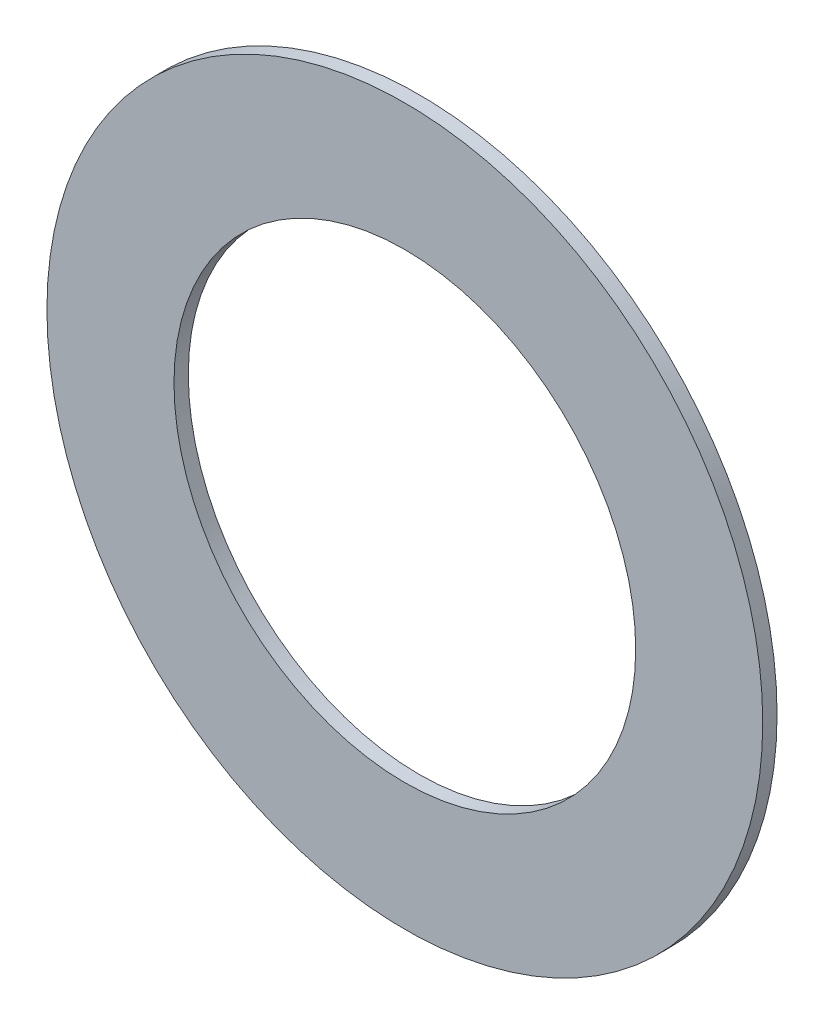
from build123d import *

# Parameters (mm, degrees)
SKETCH1_R           = 31.75
SKETCH1_R_2         = 20.47875
BOSS_EXTRUDE1_DEPTH = 1.27


with BuildPart() as part:
    # Sketch1 → Boss-Extrude1 (new body)
    with BuildSketch(Plane.XY):
        Circle(SKETCH1_R)
        Circle(SKETCH1_R_2, mode=Mode.SUBTRACT)
    extrude(amount=BOSS_EXTRUDE1_DEPTH)


solid = part.part
